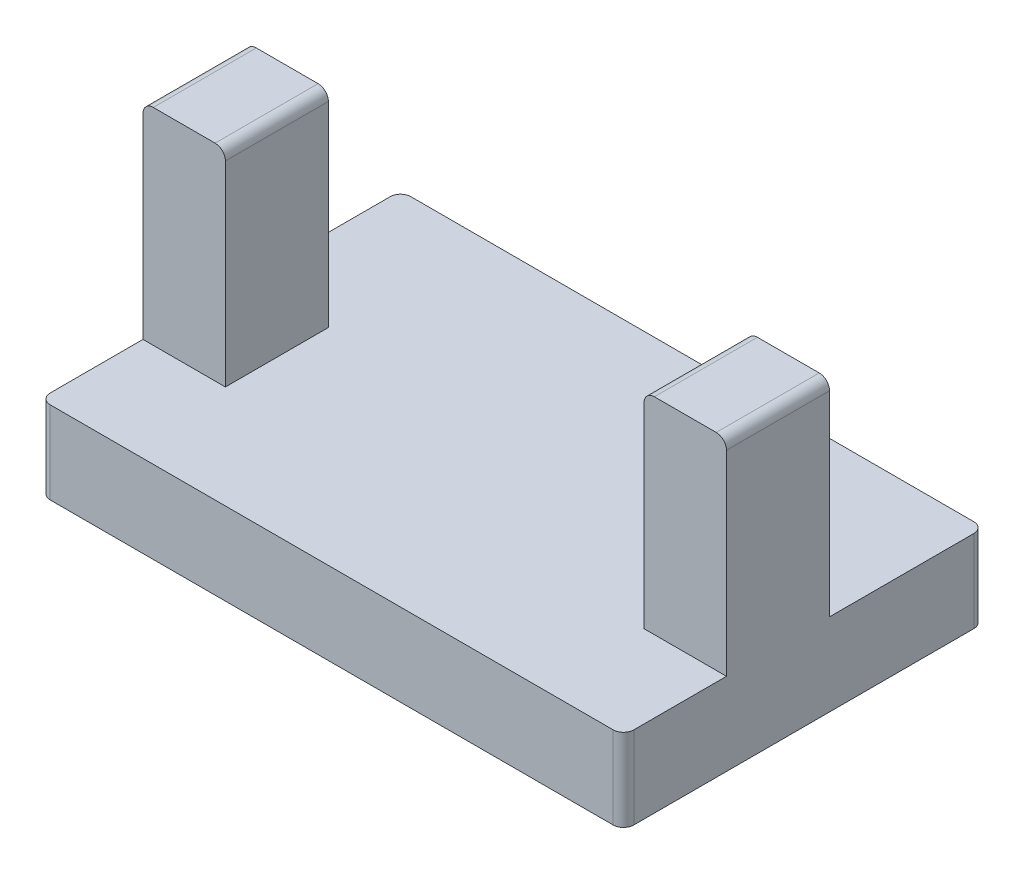
from build123d import *

# Parameters (mm, degrees)
SKETCH1_W           = 56.64
SKETCH1_H           = 35
BOSS_EXTRUDE1_DEPTH = 8
SKETCH2_W           = 8
SKETCH2_H           = 10
BOSS_EXTRUDE2_DEPTH = 20
FILLET1_R           = 1


with BuildPart() as part:
    # Sketch1 → Boss-Extrude1 (new body)
    with BuildSketch(Plane(origin=(0, 0, 0), x_dir=(1, 0, 0), z_dir=(0, 1, 0))):
        Rectangle(SKETCH1_W, SKETCH1_H)
    extrude(amount=BOSS_EXTRUDE1_DEPTH)

    # Sketch2 → Boss-Extrude2 (add)
    with BuildSketch(Plane(origin=(0, 8, 0), x_dir=(1, 0, 0), z_dir=(0, 1, 0))):
        with Locations((-24.32, -2.5)):
            Rectangle(SKETCH2_W, SKETCH2_H)
        with Locations((24.32, -2.5)):
            Rectangle(SKETCH2_W, SKETCH2_H)
    extrude(amount=BOSS_EXTRUDE2_DEPTH)

    # Fillet1
    fillet1_edges = [part.edges().sort_by_distance(p)[0] for p in [
        (-28.32, 28, 2.5),
        (-20.32, 28, 2.5),
        (28.32, 28, 2.5),
        (20.32, 28, 2.5),
        (28.32, 4, 17.5),
        (-28.32, 4, 17.5),
        (-28.32, 4, -17.5),
        (28.32, 4, -17.5),
    ]]
    fillet(fillet1_edges, radius=FILLET1_R)


solid = part.part
